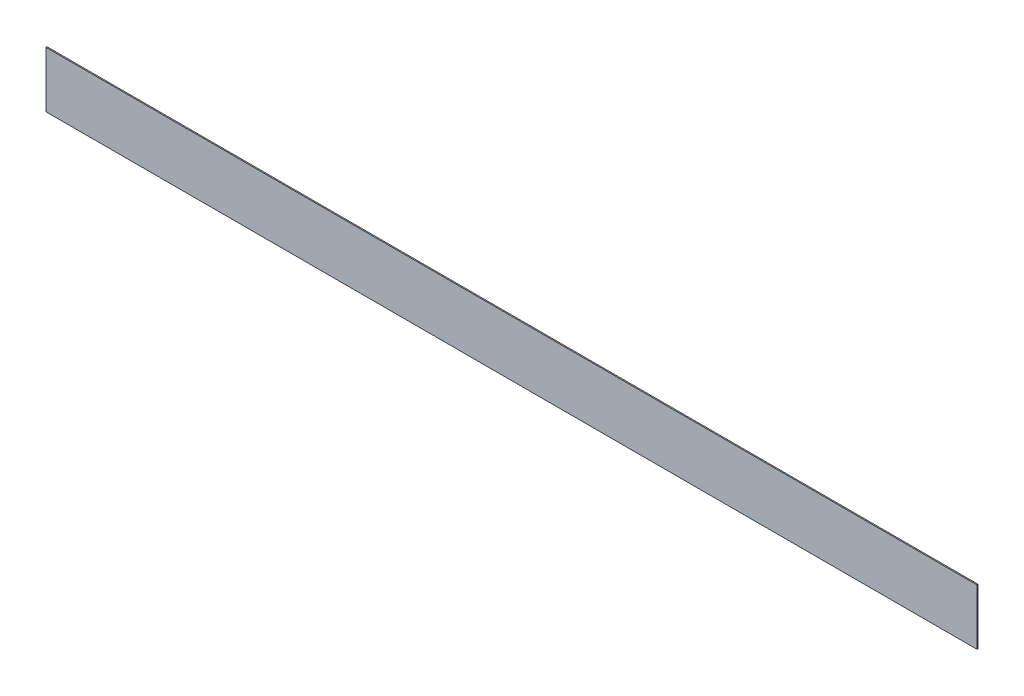
from build123d import *

# Parameters (mm, degrees)
STORE_PANEL_AYIRICI_ON_1_START = 38.5
SKETCH1_W                      = 1268
SKETCH1_H                      = 76
STORE_PANEL_AYIRICI_ON_1_DEPTH = 1.5


with BuildPart() as part:
    # Sketch1 → STORE_panel_ayirici_on_1 (new body)
    with BuildSketch(Plane.XY.offset(STORE_PANEL_AYIRICI_ON_1_START)):
        with Locations((700, 728)):
            Rectangle(SKETCH1_W, SKETCH1_H)
    extrude(amount=STORE_PANEL_AYIRICI_ON_1_DEPTH)


solid = part.part
